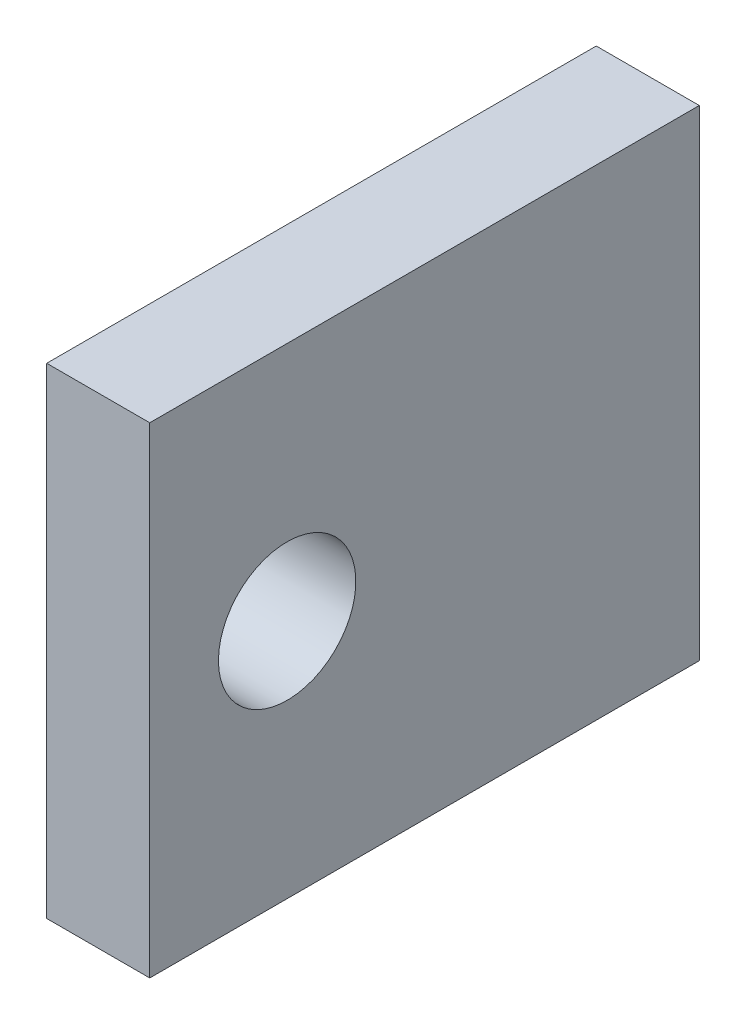
from build123d import *

# Parameters (mm, degrees)
SKETCH1_W           = 50.8
SKETCH1_H           = 44.45
SKETCH1_R           = 6.35
BOSS_EXTRUDE1_DEPTH = 9.525


with BuildPart() as part:
    # Sketch1 → Boss-Extrude1 (new body)
    with BuildSketch(Plane(origin=(0, 0, 0), x_dir=(0, 0, -1), z_dir=(1, 0, 0))):
        Rectangle(SKETCH1_W, SKETCH1_H)
        with Locations(Location((-12.7, 0, 0), (0, 0, 180))):
            Circle(SKETCH1_R, mode=Mode.SUBTRACT)
    extrude(amount=BOSS_EXTRUDE1_DEPTH)


solid = part.part
